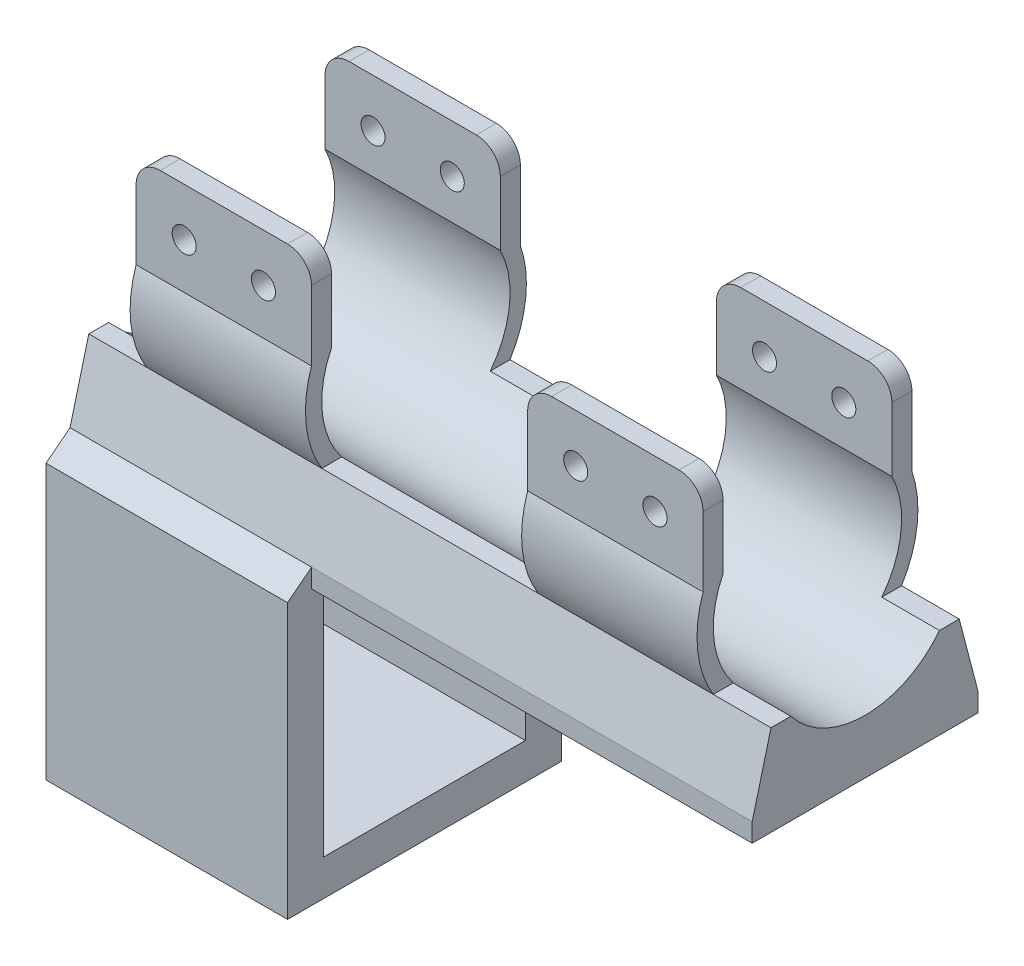
from build123d import *

# Parameters (mm, degrees)
SKETCH1_W             = 142
SKETCH1_H             = 47
BOSS_EXTRUDE1_DEPTH   = 110
SKETCH2_W             = 42
SKETCH2_H             = 49.6
CUT_EXTRUDE1_DEPTH    = 137
SKETCH4_W             = 33.598594883
SKETCH4_H             = 47
CUT_EXTRUDE3_DEPTH    = 10
CUT_EXTRUDE9_DEPTH    = 184.776508378
SKETCH8_W             = 12
SKETCH8_H             = 39.032308198
SKETCH8_W_2           = 45
CUT_EXTRUDE12_DEPTH   = 1018.719156625
SKETCH11_R            = 2.5
CUT_EXTRUDE13_DEPTH   = 1018.639266937
FILLET5_R             = 5
SKETCH13_W            = 47
SKETCH13_H            = 52.1
CUT_EXTRUDE14_DEPTH   = 91.7220084
BOSS_EXTRUDE2_DEPTH   = 50.2779916
BOSS_EXTRUDE3_DEPTH   = 50.2779916
SKETCH17_W            = 42
SKETCH17_H            = 49.6
CUT_EXTRUDE15_DEPTH   = 182.086628796
M6_TAPPED_HOLE1_D     = 5
M6_TAPPED_HOLE1_DEPTH = 15
M6_TAPPED_HOLE1_TIP   = 1.502151548


with BuildPart() as part:
    # Sketch1 → Boss-Extrude1 (new body)
    with BuildSketch(Plane(origin=(0, 0, 0), x_dir=(1, 0, 0), z_dir=(0, 1, 0))):
        with Locations((-939.664772198, 15.356209692)):
            Rectangle(SKETCH1_W, SKETCH1_H)
    extrude(amount=BOSS_EXTRUDE1_DEPTH)

    # Sketch2 → Cut-Extrude1 (cut)
    with BuildSketch(Plane(origin=(-868.664772198, 0, 0), x_dir=(0, 0, -1), z_dir=(1, 0, 0))):
        with Locations((15.356209692, 27.3)):
            Rectangle(SKETCH2_W, SKETCH2_H)
    extrude(amount=-CUT_EXTRUDE1_DEPTH, mode=Mode.SUBTRACT)

    # Sketch4 → Cut-Extrude3 (cut)
    with BuildSketch(Plane.XZ):
        with Locations((-943.587483157, -15.356209692)):
            Rectangle(SKETCH4_W, SKETCH4_H)
    extrude(amount=-CUT_EXTRUDE3_DEPTH, mode=Mode.SUBTRACT)

    # Sketch5 → Cut-Extrude9 (cut, through all)
    with BuildSketch(Plane(origin=(-868.664772198, 0, 0), x_dir=(0, 0, -1), z_dir=(1, 0, 0))):
        with BuildLine():
            Line((32.925507135, 110), (-2.21308775, 110))
            Line((-2.21308775, 110), (-2.21308775, 91.687910414))
            ThreePointArc((-2.21308775, 91.687910414), (15.356209692, 63.4), (32.925507135, 91.687910414))
            Line((32.925507135, 91.687910414), (32.925507135, 110))
        make_face()
        with BuildLine():
            Line((-6.380897296, 90.501069346), (-6.380897296, 110))
            Line((-6.380897296, 110), (-8.143790308, 110))
            Line((-8.143790308, 110), (-8.143790308, 56))
            Line((-8.143790308, 56), (-4.23948935, 70.967691802))
            ThreePointArc((-4.23948935, 70.967691802), (-7.501795977, 80.49411924), (-6.380897296, 90.501069346))
        make_face()
        with BuildLine():
            ThreePointArc((37.098087644, 90.487229439), (38.21341655, 80.486843377), (34.951908735, 70.967691802))
            Line((34.951908735, 70.967691802), (38.856209692, 56))
            Line((38.856209692, 56), (38.856209692, 110))
            Line((38.856209692, 110), (37.098087644, 110))
            Line((37.098087644, 110), (37.098087644, 90.487229439))
        make_face()
    extrude(amount=-CUT_EXTRUDE9_DEPTH, mode=Mode.SUBTRACT)

    # Sketch8 → Cut-Extrude12 (cut, through all)
    with BuildSketch(Plane.XY.offset(8.143790308)):
        with Locations((-1004.664772198, 90.483845901)):
            Rectangle(SKETCH8_W, SKETCH8_H)
        with Locations((-939.664772198, 90.483845901)):
            Rectangle(SKETCH8_W_2, SKETCH8_H)
        with Locations((-874.664772198, 90.483845901)):
            Rectangle(SKETCH8_W, SKETCH8_H)
    extrude(amount=-CUT_EXTRUDE12_DEPTH, mode=Mode.SUBTRACT)

    # Sketch11 → Cut-Extrude13 (cut, through all)
    with BuildSketch(Plane.XY.offset(6.380897296)):
        with Locations((-988.664772198, 100)):
            Circle(SKETCH11_R)
        with Locations((-972.164772198, 100)):
            Circle(SKETCH11_R)
        with Locations((-907.164772198, 100)):
            Circle(SKETCH11_R)
        with Locations((-890.664772198, 100)):
            Circle(SKETCH11_R)
    extrude(amount=-CUT_EXTRUDE13_DEPTH, mode=Mode.SUBTRACT)

    # Fillet5
    fillet5_edges = [part.edges().sort_by_distance(p)[0] for p in [
        (-998.664772198, 110, 4.296992523),
        (-998.664772198, 110, -35.01179739),
        (-917.164772198, 110, 4.296992523),
        (-962.164772198, 110, 4.296992523),
        (-962.164772198, 110, -35.01179739),
        (-917.164772198, 110, -35.01179739),
        (-880.664772198, 110, 4.296992523),
        (-880.664772198, 110, -35.01179739),
    ]]
    fillet(fillet5_edges, radius=FILLET5_R)

    # Sketch13 → Cut-Extrude14 (cut)
    with BuildSketch(Plane(origin=(-868.664772198, 0, 0), x_dir=(0, 0, -1), z_dir=(1, 0, 0))):
        with Locations((15.356209692, 26.05)):
            Rectangle(SKETCH13_W, SKETCH13_H)
    extrude(amount=-CUT_EXTRUDE14_DEPTH, mode=Mode.SUBTRACT)

    # Sketch15 → Boss-Extrude2 (add)
    with BuildSketch(Plane(origin=(-960.386780598, 0, 0), x_dir=(0, 0, -1), z_dir=(1, 0, 0))):
        Polygon((-8.143790308, 52.1), (-13.143790308, 52.1), (-13.143790308, -5), (43.856209692, -5), (43.856209692, 52.1), (38.856209692, 52.1), (38.856209692, 0), (-8.143790308, 0), align=None)
    extrude(amount=-BOSS_EXTRUDE2_DEPTH)

    # Sketch16 → Boss-Extrude3 (add)
    with BuildSketch(Plane.ZY.offset(1010.664772198)):
        Polygon((-38.856209692, 56), (-43.856209692, 52.1), (-38.856209692, 52.1), align=None)
        Polygon((8.143790308, 56), (13.143790308, 52.1), (8.143790308, 52.1), align=None)
    extrude(amount=-BOSS_EXTRUDE3_DEPTH)

    # Sketch17 → Cut-Extrude15 (cut, through all)
    with BuildSketch(Plane(origin=(-1005.664772198, 0, 0), x_dir=(0, 0, -1), z_dir=(1, 0, 0))):
        with Locations((15.356209692, 27.3)):
            Rectangle(SKETCH17_W, SKETCH17_H)
    extrude(amount=-CUT_EXTRUDE15_DEPTH, mode=Mode.SUBTRACT)

    # M6 Tapped Hole1
    with Locations(Plane(origin=(-1010.664772198, 46, -40.106209692), x_dir=(0, 0, -1), z_dir=(-1, 0, 0))):
        with Locations((0, 0), (0, 45), (-49.5, 45), (-49.5, 0)):
            Hole(M6_TAPPED_HOLE1_D / 2, depth=M6_TAPPED_HOLE1_DEPTH)
            with Locations((0, 0, -(M6_TAPPED_HOLE1_DEPTH + M6_TAPPED_HOLE1_TIP / 2))):  # 118° drill point
                Cone(0, M6_TAPPED_HOLE1_D / 2, M6_TAPPED_HOLE1_TIP, mode=Mode.SUBTRACT)


solid = part.part
